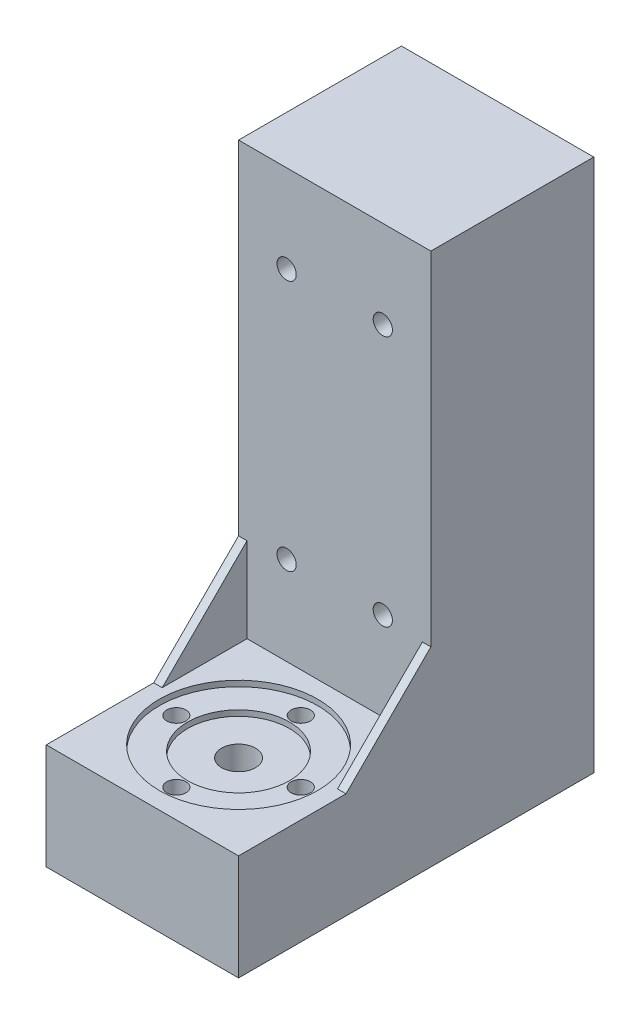
from build123d import *

# Parameters (mm, degrees)
BOSS_EXTRUDE1_DEPTH = 17
SKETCH2_R           = 1.7
CUT_EXTRUDE1_DEPTH  = 102.673447861
SKETCH5_R           = 14
CUT_EXTRUDE3_DEPTH  = 1
SKETCH4_R           = 9
CUT_EXTRUDE2_DEPTH  = 2
SKETCH6_R           = 1.7
SKETCH6_R_2         = 3
CUT_EXTRUDE4_DEPTH  = 101.500746266
BOSS_EXTRUDE2_DEPTH = 1.5
BOSS_EXTRUDE3_DEPTH = 1.5


with BuildPart() as part:
    # Sketch1 → Boss-Extrude1 (new, symmetric)
    with BuildSketch(Plane(origin=(0, 0, 0), x_dir=(0, 0, -1), z_dir=(1, 0, 0))):
        Polygon((0, 0), (62.8, 0), (62.8, 94.3), (34, 94.3), (34, 18.7), (0, 18.7), align=None)
    extrude(amount=BOSS_EXTRUDE1_DEPTH, both=True)

    # Sketch2 → Cut-Extrude1 (cut, through all)
    with BuildSketch(Plane.XY.offset(-34)):
        with Locations((8.5, 34.35)):
            Circle(SKETCH2_R)
        with Locations((8.5, 78.8)):
            Circle(SKETCH2_R)
        with Locations(Location((-8.5, 34.35, 0), (0, 0, 180))):
            Circle(SKETCH2_R)
        with Locations(Location((-8.5, 78.8, 0), (0, 0, 180))):
            Circle(SKETCH2_R)
    extrude(amount=-CUT_EXTRUDE1_DEPTH, mode=Mode.SUBTRACT)

    # Sketch5 → Cut-Extrude3 (cut)
    with BuildSketch(Plane(origin=(0, 18.7, 0), x_dir=(1, 0, 0), z_dir=(0, 1, 0))):
        with Locations(Location((0, 17, 0), (0, 0, 270))):
            Circle(SKETCH5_R)
    extrude(amount=-CUT_EXTRUDE3_DEPTH, mode=Mode.SUBTRACT)

    # Sketch4 → Cut-Extrude2 (cut)
    with BuildSketch(Plane(origin=(0, 18.7, 0), x_dir=(1, 0, 0), z_dir=(0, 1, 0))):
        with Locations(Location((0, 17, 0), (0, 0, 270))):
            Circle(SKETCH4_R)
    extrude(amount=-CUT_EXTRUDE2_DEPTH, mode=Mode.SUBTRACT)

    # Sketch6 → Cut-Extrude4 (cut, through all)
    with BuildSketch(Plane(origin=(0, 17.7, 0), x_dir=(1, 0, 0), z_dir=(0, 1, 0))):
        with Locations(Location((0, 6, 0), (0, 0, 270))):
            Circle(SKETCH6_R)
        with Locations(Location((0, 28, 0), (0, 0, 270))):
            Circle(SKETCH6_R)
        with Locations(Location((11, 17, 0), (0, 0, 270))):
            Circle(SKETCH6_R)
        with Locations(Location((-11, 17, 0), (0, 0, 270))):
            Circle(SKETCH6_R)
        with Locations(Location((0, 17, 0), (0, 0, 270))):
            Circle(SKETCH6_R_2)
    extrude(amount=-CUT_EXTRUDE4_DEPTH, mode=Mode.SUBTRACT)

    # Sketch8 → Boss-Extrude2 (add)
    with BuildSketch(Plane(origin=(17, 0, 0), x_dir=(0, 0, -1), z_dir=(1, 0, 0))):
        Polygon((34, 18.7), (34, 33.7), (19, 18.7), align=None)
    extrude(amount=-BOSS_EXTRUDE2_DEPTH)


with BuildPart() as body_2:
    # Sketch9 → Boss-Extrude3 (new body)
    with BuildSketch(Plane.ZY.offset(17)):
        Polygon((-34, 18.7), (-19, 18.7), (-34, 33.7), align=None)
    extrude(amount=-BOSS_EXTRUDE3_DEPTH)


solid = Compound([part.part, body_2.part])
